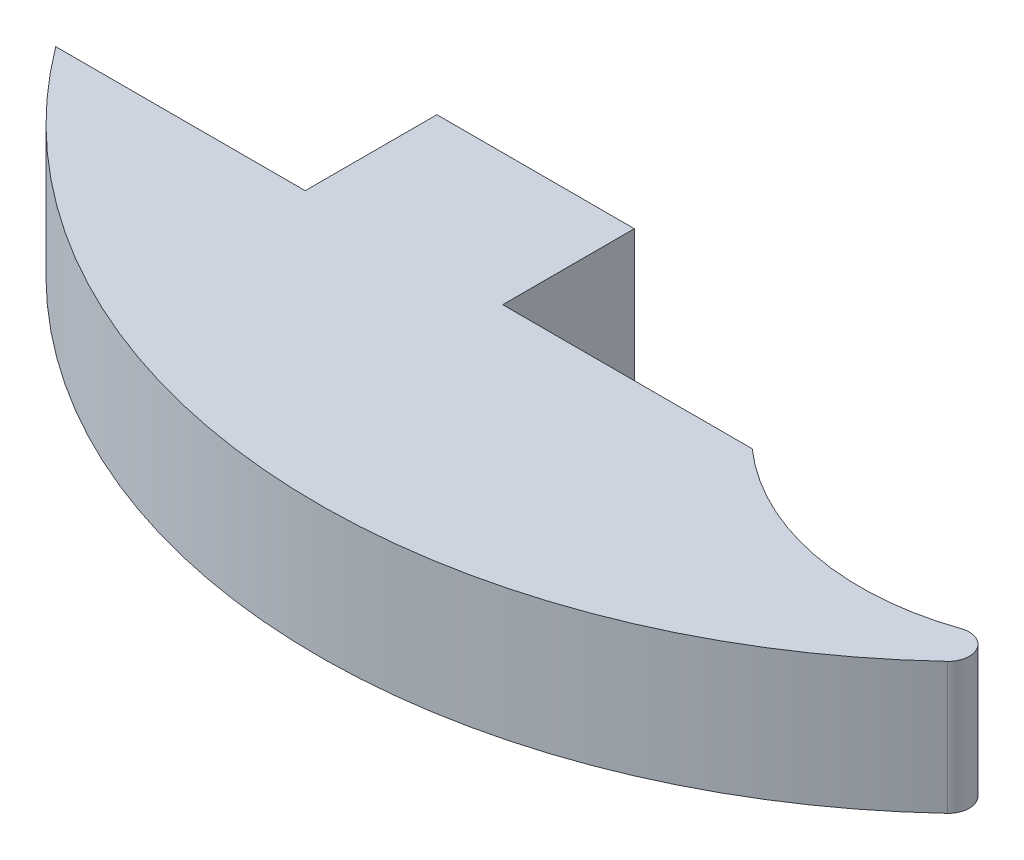
from build123d import *

# Parameters (mm, degrees)
BOSS_EXTRUDE1_DEPTH = 3.175
SKETCH2_W           = 9.525
SKETCH2_H           = 6.35
BOSS_EXTRUDE2_DEPTH = 6.35
CUT_EXTRUDE1_DEPTH  = 79.159931038


with BuildPart() as part:
    # Sketch1 → Boss-Extrude1 (new, symmetric)
    with BuildSketch(Plane(origin=(0, 0, 0), x_dir=(1, 0, 0), z_dir=(0, 1, 0))):
        with BuildLine():
            Line((-41.502443258, -43.180856192), (-54.202443258, -43.180856192))
            ThreePointArc((-54.202443258, -43.180856192), (-26.821849193, -55.894576411), (-1.182977367, -39.95770518))
            ThreePointArc((-1.182977367, -39.95770518), (-10.130448134, -46.184581497), (-20.609420226, -43.180856192))
            Line((-20.609420226, -43.180856192), (-41.502443258, -43.180856192))
        make_face()
    extrude(amount=BOSS_EXTRUDE1_DEPTH, both=True)

    # Sketch2 → Boss-Extrude2 (add)
    with BuildSketch(Plane(origin=(0, 3.175, 0), x_dir=(1, 0, 0), z_dir=(0, 1, 0))):
        with Locations((-37.405931742, -40.005856192)):
            Rectangle(SKETCH2_W, SKETCH2_H)
    extrude(amount=-BOSS_EXTRUDE2_DEPTH)

    # Sketch3 → Cut-Extrude1 (cut, through all)
    with BuildSketch(Plane(origin=(0, 3.175, 0), x_dir=(1, 0, 0), z_dir=(0, 1, 0))):
        with BuildLine():
            ThreePointArc((-1.182977367, -39.95770518), (-4.100263319, -43.430097731), (-8.051614181, -45.656056787))
            ThreePointArc((-8.051614181, -45.656056787), (-6.849431822, -46.090631239), (-7.023822995, -47.356998128))
            ThreePointArc((-7.023822995, -47.356998128), (-3.827256735, -43.87533346), (-1.182977367, -39.95770518))
        make_face()
    extrude(amount=-CUT_EXTRUDE1_DEPTH, mode=Mode.SUBTRACT)


solid = part.part
